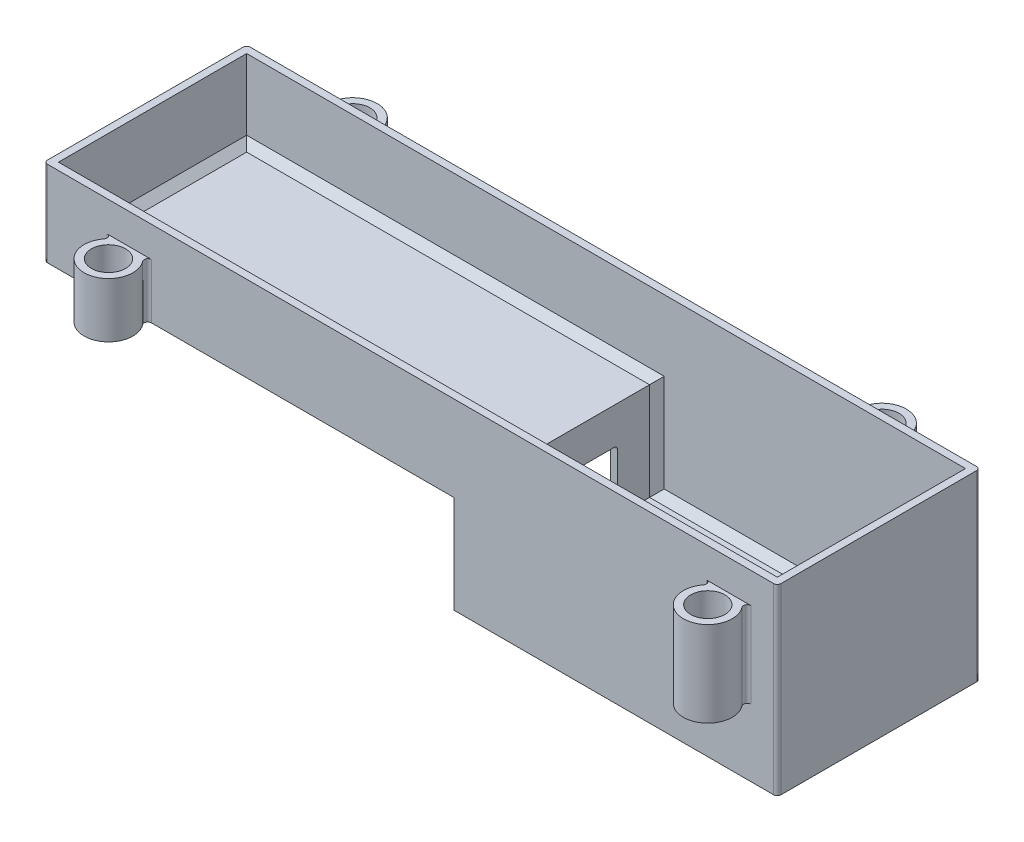
from build123d import *

# Parameters (mm, degrees)
SKETCH1_W                      = 120.25
SKETCH1_H                      = 33.25
BOSS_EXTRUDE1_DEPTH            = 14
CUT_EXTRUDE1_REACH             = 67.133
CUT_EXTRUDE1_START             = 1.2
SKETCH1_3_W                    = 117.85
SKETCH1_3_H                    = 30.85
SKETCH2_W                      = 53
SKETCH2_H                      = 33.25
BOSS_EXTRUDE2_DEPTH            = 16
SKETCH2_3_W                    = 50.6
SKETCH2_3_H                    = 30.85
CUT_EXTRUDE2_DEPTH             = 14.8
CUT_EXTRUDE2_DIRECTION_2_REACH = 66.4
SKETCH3_W                      = 18
SKETCH3_H                      = 10
CUT_EXTRUDE4_DEPTH             = 8.325
SKETCH1_4_R                    = 4
BOSS_EXTRUDE3_DEPTH            = 9
BOSS_EXTRUDE4_START            = -5
SKETCH1_5_R                    = 4
BOSS_EXTRUDE4_DEPTH            = 5
CUT_EXTRUDE5_START             = 9
SKETCH1_6_R                    = 2.8
CUT_EXTRUDE5_DEPTH             = 6
CUT_EXTRUDE6_START             = 2
SKETCH1_7_R                    = 2.8
CUT_EXTRUDE6_DEPTH             = 7
CUT_EXTRUDE7_DEPTH             = 67.694949209
CUT_EXTRUDE7_DEPTH_BACK        = 67.694949209
SKETCH1_8_R                    = 1.3
CUT_EXTRUDE8_START             = 2
SKETCH1_9_R                    = 2.8
CUT_EXTRUDE8_DEPTH             = 2
FILLET1_R                      = 0.6
CHAMFER1_SIZE                  = 1.2


with BuildPart() as part:
    # Sketch1 → Boss-Extrude1 (new body)
    with BuildSketch(Plane(origin=(0, 0, 0), x_dir=(1, 0, 0), z_dir=(0, 1, 0))):
        Rectangle(SKETCH1_W, SKETCH1_H)
    extrude(amount=BOSS_EXTRUDE1_DEPTH)

    # Sketch1<3> → Cut-Extrude1 (cut, up to next)
    with BuildSketch(Plane(origin=(0, 0, 0), x_dir=(1, 0, 0), z_dir=(0, 1, 0)).offset(CUT_EXTRUDE1_START), mode=Mode.PRIVATE) as cut_extrude1_sk1:
        Rectangle(SKETCH1_3_W, SKETCH1_3_H)
    cut_extrude1_tool1 = extrude(cut_extrude1_sk1.sketch, amount=CUT_EXTRUDE1_REACH, mode=Mode.PRIVATE) & part.part
    add(cut_extrude1_tool1.solids().sort_by_distance((0, 1.2, 0))[0], mode=Mode.SUBTRACT)

    # Sketch2 → Boss-Extrude2 (add)
    with BuildSketch(Plane(origin=(0, 0, 0), x_dir=(1, 0, 0), z_dir=(0, 1, 0))):
        with Locations((33.625, 0)):
            Rectangle(SKETCH2_W, SKETCH2_H)
    extrude(amount=-BOSS_EXTRUDE2_DEPTH)

    # Sketch2<3> → Cut-Extrude2 (cut)
    with BuildSketch(Plane(origin=(0, 0, 0), x_dir=(1, 0, 0), z_dir=(0, 1, 0))):
        with Locations((33.625, 0)):
            Rectangle(SKETCH2_3_W, SKETCH2_3_H)
    extrude(amount=-CUT_EXTRUDE2_DEPTH, mode=Mode.SUBTRACT)

    # Sketch2<3> → Cut-Extrude2 direction 2 (cut, up to next)
    with BuildSketch(Plane(origin=(0, 0, 0), x_dir=(1, 0, 0), z_dir=(0, 1, 0)), mode=Mode.PRIVATE) as cut_extrude2_direction_2_sk1:
        with Locations((33.625, 0)):
            Rectangle(SKETCH2_3_W, SKETCH2_3_H)
    cut_extrude2_direction_2_tool1 = extrude(cut_extrude2_direction_2_sk1.sketch, amount=CUT_EXTRUDE2_DIRECTION_2_REACH, mode=Mode.PRIVATE) & part.part
    add(cut_extrude2_direction_2_tool1.solids().sort_by_distance((33.625, 0, 0))[0], mode=Mode.SUBTRACT)

    # Sketch3 → Cut-Extrude4 (cut)
    with BuildSketch(Plane(origin=(0, 0, 0), x_dir=(0, 0, -1), z_dir=(1, 0, 0))):
        with Locations((0, -9.8)):
            Rectangle(SKETCH3_W, SKETCH3_H)
    extrude(amount=CUT_EXTRUDE4_DEPTH, mode=Mode.SUBTRACT)

    # Sketch1<4> → Boss-Extrude3 (add)
    with BuildSketch(Plane(origin=(0, 0, 0), x_dir=(1, 0, 0), z_dir=(0, 1, 0))):
        with Locations((-46.125, -20.025)):
            Circle(SKETCH1_4_R)
        with Locations((52.125, -20.025)):
            Circle(SKETCH1_4_R)
        with Locations((-46.125, 20.025)):
            Circle(SKETCH1_4_R)
        with Locations((40.625, 20.025)):
            Circle(SKETCH1_4_R)
    extrude(amount=BOSS_EXTRUDE3_DEPTH)

    # Sketch1<5> → Boss-Extrude4 (add)
    with BuildSketch(Plane(origin=(0, 0, 0), x_dir=(1, 0, 0), z_dir=(0, 1, 0)).offset(BOSS_EXTRUDE4_START)):
        with Locations((52.125, -20.025)):
            Circle(SKETCH1_5_R)
    extrude(amount=BOSS_EXTRUDE4_DEPTH)

    # Sketch1<6> → Cut-Extrude5 (cut)
    with BuildSketch(Plane(origin=(0, 0, 0), x_dir=(1, 0, 0), z_dir=(0, 1, 0)).offset(CUT_EXTRUDE5_START)):
        with Locations(Location((-46.125, 20.025, 0), (0, 0, 270))):
            Circle(SKETCH1_6_R)
        with Locations(Location((-46.125, -20.025, 0), (0, 0, 270))):
            Circle(SKETCH1_6_R)
        with Locations(Location((52.125, -20.025, 0), (0, 0, 270))):
            Circle(SKETCH1_6_R)
        with Locations(Location((40.625, 20.025, 0), (0, 0, 270))):
            Circle(SKETCH1_6_R)
    extrude(amount=-CUT_EXTRUDE5_DEPTH, mode=Mode.SUBTRACT)

    # Sketch1<7> → Cut-Extrude6 (cut)
    with BuildSketch(Plane(origin=(0, 0, 0), x_dir=(1, 0, 0), z_dir=(0, 1, 0)).offset(CUT_EXTRUDE6_START)):
        with Locations(Location((52.125, -20.025, 0), (0, 0, 270))):
            Circle(SKETCH1_7_R)
    extrude(amount=-CUT_EXTRUDE6_DEPTH, mode=Mode.SUBTRACT)

    # Sketch1<8> → Cut-Extrude7 (cut, two sides: drawn at the far end of the back side and taken through both)
    with BuildSketch(Plane(origin=(0, 0, 0), x_dir=(1, 0, 0), z_dir=(0, 1, 0)).offset(-CUT_EXTRUDE7_DEPTH_BACK)):
        with Locations(Location((-46.125, 20.025, 0), (0, 0, 270))):
            Circle(SKETCH1_8_R)
        with Locations(Location((-46.125, -20.025, 0), (0, 0, 270))):
            Circle(SKETCH1_8_R)
        with Locations(Location((52.125, -20.025, 0), (0, 0, 270))):
            Circle(SKETCH1_8_R)
        with Locations(Location((40.625, 20.025, 0), (0, 0, 270))):
            Circle(SKETCH1_8_R)
    extrude(amount=CUT_EXTRUDE7_DEPTH + CUT_EXTRUDE7_DEPTH_BACK, mode=Mode.SUBTRACT)

    # Sketch1<9> → Cut-Extrude8 (cut)
    with BuildSketch(Plane(origin=(0, 0, 0), x_dir=(1, 0, 0), z_dir=(0, 1, 0)).offset(CUT_EXTRUDE8_START)):
        with Locations(Location((-46.125, 20.025, 0), (0, 0, 270))):
            Circle(SKETCH1_9_R)
        with Locations(Location((-46.125, -20.025, 0), (0, 0, 270))):
            Circle(SKETCH1_9_R)
        with Locations(Location((40.625, 20.025, 0), (0, 0, 270))):
            Circle(SKETCH1_9_R)
    extrude(amount=-CUT_EXTRUDE8_DEPTH, mode=Mode.SUBTRACT)

    # Fillet1
    fillet1_edges = [part.edges().sort_by_distance(p)[0] for p in [
        (7.725, -4.8, 9),
        (7.725, -14.8, 9),
        (7.725, -14.8, -9),
        (7.725, -4.8, -9),
        (54.232130751, 2, 16.625),
        (50.017869249, 2, 16.625),
        (60.125, -1, 16.625),
        (-48.232130751, 4.5, 16.625),
        (-44.017869249, 4.5, 16.625),
        (-60.125, 7, 16.625),
        (-60.125, 7, -16.625),
        (60.125, -1, -16.625),
        (42.732130751, 4.5, -16.625),
        (38.517869249, 4.5, -16.625),
        (-48.232130751, 4.5, -16.625),
        (-44.017869249, 4.5, -16.625),
    ]]
    fillet(fillet1_edges, radius=FILLET1_R)

    # Chamfer1
    chamfer1_edges = [part.edges().sort_by_distance(p)[0] for p in [
        (-58.925, 1.2, 0),
        (-25.3, 1.2, -15.425),
        (-25.3, 1.2, 15.425),
        (8.325, -6.8, -15.425),
        (8.325, -6.8, 15.425),
        (33.625, -14.8, 15.425),
        (58.925, -14.8, 0),
        (33.625, -14.8, -15.425),
    ]]
    chamfer(chamfer1_edges, length=CHAMFER1_SIZE)


solid = part.part
